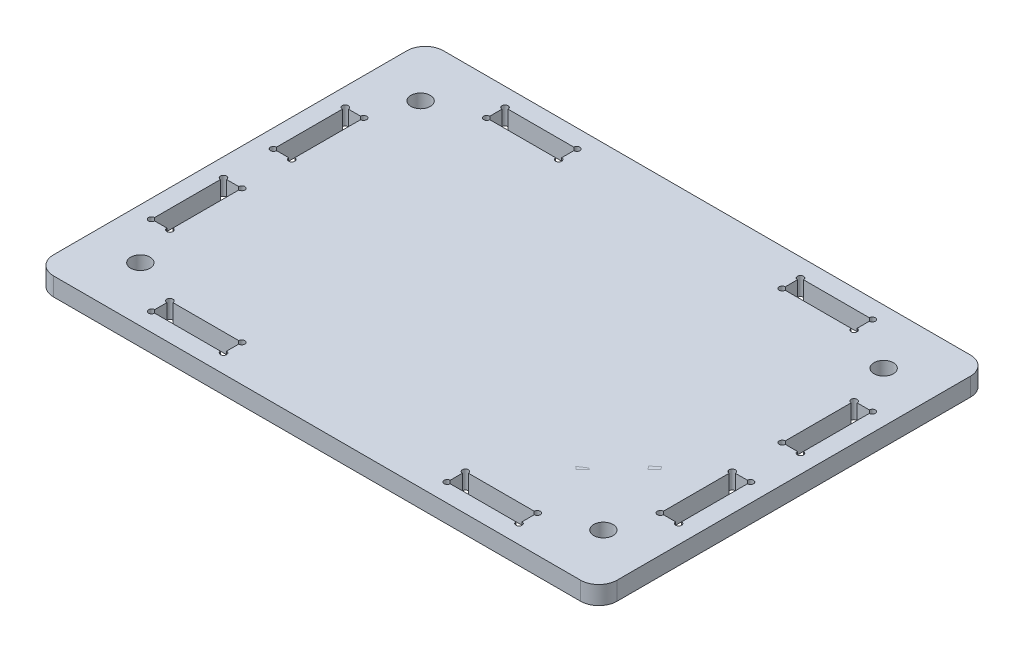
from build123d import *

# Parameters (mm, degrees)
SKETCH5_R              = 1.5875
BOSS_EXTRUDE1_DEPTH    = 3
SKETCH6_R              = 5
SKETCH6_R_2            = 3.5
BOSS_EXTRUDE2_DEPTH    = 0.2
SKETCH6_R_3            = 2
BOSS_EXTRUDE2_2_DEPTH  = 0.2
BOSS_EXTRUDE2_3_DEPTH  = 0.2
BOSS_EXTRUDE2_4_DEPTH  = 0.2
BOSS_EXTRUDE2_5_DEPTH  = 0.2
BOSS_EXTRUDE2_6_DEPTH  = 0.2
BOSS_EXTRUDE2_7_DEPTH  = 0.2
BOSS_EXTRUDE2_8_DEPTH  = 0.2
BOSS_EXTRUDE2_9_DEPTH  = 0.2
BOSS_EXTRUDE2_10_DEPTH = 0.2
BOSS_EXTRUDE2_11_DEPTH = 0.2
SKETCH6_W              = 7.5
SKETCH6_H              = 1.875
BOSS_EXTRUDE2_12_DEPTH = 0.2
BOSS_EXTRUDE2_13_DEPTH = 0.2
BOSS_EXTRUDE2_14_DEPTH = 0.2
BOSS_EXTRUDE2_15_DEPTH = 0.2
BOSS_EXTRUDE2_16_DEPTH = 0.2
BOSS_EXTRUDE2_17_DEPTH = 0.2
BOSS_EXTRUDE2_18_DEPTH = 0.2
BOSS_EXTRUDE2_19_DEPTH = 0.2
SKETCH6_H_2            = 7.5
BOSS_EXTRUDE2_20_DEPTH = 0.2


with BuildPart() as part:
    # Sketch5 → Boss-Extrude1 (new body)
    with BuildSketch(Plane(origin=(0, 0, 0), x_dir=(1, 0, 0), z_dir=(0, 1, 0))):
        with BuildLine():
            Line((-3.25, -7), (83.25, -7))
            ThreePointArc((83.25, -7), (85.371320344, -6.121320344), (86.25, -4))
            Line((86.25, -4), (86.25, 54))
            ThreePointArc((86.25, 54), (85.371320344, 56.121320344), (83.25, 57))
            Line((83.25, 57), (-3.25, 57))
            ThreePointArc((-3.25, 57), (-5.371320344, 56.121320344), (-6.25, 54))
            Line((-6.25, 54), (-6.25, -4))
            ThreePointArc((-6.25, -4), (-5.371320344, -6.121320344), (-3.25, -7))
        make_face()
        with Locations(Location((2, 2, 0), (0, 0, 270))):
            Circle(SKETCH5_R, mode=Mode.SUBTRACT)
        with Locations(Location((2, 48, 0), (0, 0, 270))):
            Circle(SKETCH5_R, mode=Mode.SUBTRACT)
        with Locations(Location((78, 48, 0), (0, 0, 270))):
            Circle(SKETCH5_R, mode=Mode.SUBTRACT)
        with Locations(Location((78, 2, 0), (0, 0, 270))):
            Circle(SKETCH5_R, mode=Mode.SUBTRACT)
        with BuildLine():
            Line((10.353326987, 54), (21.153326987, 54))
            ThreePointArc((21.153326987, 54), (22.006880378, 54.353553391), (21.653326987, 53.5))
            Line((21.653326987, 53.5), (21.653326987, 51.5))
            ThreePointArc((21.653326987, 51.5), (22.006880378, 50.646446609), (21.153326987, 51))
            Line((21.153326987, 51), (10.353326987, 51))
            ThreePointArc((10.353326987, 51), (9.499773597, 50.646446609), (9.853326987, 51.5))
            Line((9.853326987, 51.5), (9.853326987, 53.5))
            ThreePointArc((9.853326987, 53.5), (9.499773597, 54.353553391), (10.353326987, 54))
        make_face(mode=Mode.SUBTRACT)
        with BuildLine():
            Line((58.85, 54), (69.65, 54))
            ThreePointArc((69.65, 54), (70.503553391, 54.353553391), (70.15, 53.5))
            Line((70.15, 53.5), (70.15, 51.5))
            ThreePointArc((70.15, 51.5), (70.503553391, 50.646446609), (69.65, 51))
            Line((69.65, 51), (58.85, 51))
            ThreePointArc((58.85, 51), (57.996446609, 50.646446609), (58.35, 51.5))
            Line((58.35, 51.5), (58.35, 53.5))
            ThreePointArc((58.35, 53.5), (57.996446609, 54.353553391), (58.85, 54))
        make_face(mode=Mode.SUBTRACT)
        with BuildLine():
            Line((10.35, -1), (21.15, -1))
            ThreePointArc((21.15, -1), (22.003553391, -0.646446609), (21.65, -1.5))
            Line((21.65, -1.5), (21.65, -3.5))
            ThreePointArc((21.65, -3.5), (22.003553391, -4.353553391), (21.15, -4))
            Line((21.15, -4), (10.35, -4))
            ThreePointArc((10.35, -4), (9.496446609, -4.353553391), (9.85, -3.5))
            Line((9.85, -3.5), (9.85, -1.5))
            ThreePointArc((9.85, -1.5), (9.496446609, -0.646446609), (10.35, -1))
        make_face(mode=Mode.SUBTRACT)
        with BuildLine():
            Line((58.85, -1), (69.65, -1))
            ThreePointArc((69.65, -1), (70.503553391, -0.646446609), (70.15, -1.5))
            Line((70.15, -1.5), (70.15, -3.5))
            ThreePointArc((70.15, -3.5), (70.503553391, -4.353553391), (69.65, -4))
            Line((69.65, -4), (58.85, -4))
            ThreePointArc((58.85, -4), (57.996446609, -4.353553391), (58.35, -3.5))
            Line((58.35, -3.5), (58.35, -1.5))
            ThreePointArc((58.35, -1.5), (57.996446609, -0.646446609), (58.85, -1))
        make_face(mode=Mode.SUBTRACT)
        with BuildLine():
            Line((-3.25, 9.6), (-3.25, 20.4))
            ThreePointArc((-3.25, 20.4), (-3.603553391, 21.253553391), (-2.75, 20.9))
            Line((-2.75, 20.9), (-0.75, 20.9))
            ThreePointArc((-0.75, 20.9), (0.103553391, 21.253553391), (-0.25, 20.4))
            Line((-0.25, 20.4), (-0.25, 9.6))
            ThreePointArc((-0.25, 9.6), (0.103553391, 8.746446609), (-0.75, 9.1))
            Line((-0.75, 9.1), (-2.75, 9.1))
            ThreePointArc((-2.75, 9.1), (-3.603553391, 8.746446609), (-3.25, 9.6))
        make_face(mode=Mode.SUBTRACT)
        with BuildLine():
            Line((-3.25, 29.6), (-3.25, 40.4))
            ThreePointArc((-3.25, 40.4), (-3.603553391, 41.253553391), (-2.75, 40.9))
            Line((-2.75, 40.9), (-0.75, 40.9))
            ThreePointArc((-0.75, 40.9), (0.103553391, 41.253553391), (-0.25, 40.4))
            Line((-0.25, 40.4), (-0.25, 29.6))
            ThreePointArc((-0.25, 29.6), (0.103553391, 28.746446609), (-0.75, 29.1))
            Line((-0.75, 29.1), (-2.75, 29.1))
            ThreePointArc((-2.75, 29.1), (-3.603553391, 28.746446609), (-3.25, 29.6))
        make_face(mode=Mode.SUBTRACT)
        with BuildLine():
            Line((80.25, 9.6), (80.25, 20.4))
            ThreePointArc((80.25, 20.4), (79.896446609, 21.253553391), (80.75, 20.9))
            Line((80.75, 20.9), (82.75, 20.9))
            ThreePointArc((82.75, 20.9), (83.603553391, 21.253553391), (83.25, 20.4))
            Line((83.25, 20.4), (83.25, 9.6))
            ThreePointArc((83.25, 9.6), (83.603553391, 8.746446609), (82.75, 9.1))
            Line((82.75, 9.1), (80.75, 9.1))
            ThreePointArc((80.75, 9.1), (79.896446609, 8.746446609), (80.25, 9.6))
        make_face(mode=Mode.SUBTRACT)
        with BuildLine():
            Line((80.25, 29.6), (80.25, 40.4))
            ThreePointArc((80.25, 40.4), (79.896446609, 41.253553391), (80.75, 40.9))
            Line((80.75, 40.9), (82.75, 40.9))
            ThreePointArc((82.75, 40.9), (83.603553391, 41.253553391), (83.25, 40.4))
            Line((83.25, 40.4), (83.25, 29.6))
            ThreePointArc((83.25, 29.6), (83.603553391, 28.746446609), (82.75, 29.1))
            Line((82.75, 29.1), (80.75, 29.1))
            ThreePointArc((80.75, 29.1), (79.896446609, 28.746446609), (80.25, 29.6))
        make_face(mode=Mode.SUBTRACT)
    extrude(amount=BOSS_EXTRUDE1_DEPTH)


with BuildPart() as body_2:
    # Sketch6 → Boss-Extrude2 (new body)
    with BuildSketch(Plane(origin=(0, 3, 0), x_dir=(1, 0, 0), z_dir=(0, 1, 0))):
        with Locations(Location((70, 37.5, 0), (0, 0, 270))):
            Circle(SKETCH6_R)
        with Locations(Location((70, 37.5, 0), (0, 0, 270))):
            Circle(SKETCH6_R_2, mode=Mode.SUBTRACT)
    extrude(amount=-BOSS_EXTRUDE2_DEPTH)


with BuildPart() as body_3:
    # Sketch6 → Boss-Extrude2 2 (new body)
    with BuildSketch(Plane(origin=(0, 3, 0), x_dir=(1, 0, 0), z_dir=(0, 1, 0))):
        with Locations(Location((70, 37.5, 0), (0, 0, 270))):
            Circle(SKETCH6_R_3)
    extrude(amount=-BOSS_EXTRUDE2_2_DEPTH)


with BuildPart() as body_4:
    # Sketch6 → Boss-Extrude2 3 (new body)
    with BuildSketch(Plane(origin=(0, 3, 0), x_dir=(1, 0, 0), z_dir=(0, 1, 0))):
        with BuildLine():
            Line((72.759643105, 8.330543209), (73.173589571, 7.70512469))
            Line((73.173589571, 7.70512469), (71.094859602, 8.128068796))
            Line((71.094859602, 8.128068796), (71.517803708, 10.206798765))
            Line((71.517803708, 10.206798765), (71.931750173, 9.581380246))
            ThreePointArc((71.931750173, 9.581380246), (73.351504822, 13.50867013), (70, 16))
            Line((70, 16), (70, 17.5))
            ThreePointArc((70, 17.5), (74.787864031, 13.940957328), (72.759643105, 8.330543209))
        make_face()
    extrude(amount=-BOSS_EXTRUDE2_3_DEPTH)


with BuildPart() as body_5:
    # Sketch6 → Boss-Extrude2 4 (new body)
    with BuildSketch(Plane(origin=(0, 3, 0), x_dir=(1, 0, 0), z_dir=(0, 1, 0))):
        with BuildLine():
            Line((67.240356895, 16.669456791), (66.826410429, 17.29487531))
            Line((66.826410429, 17.29487531), (68.905140398, 16.871931204))
            Line((68.905140398, 16.871931204), (68.482196292, 14.793201235))
            Line((68.482196292, 14.793201235), (68.068249827, 15.418619754))
            ThreePointArc((68.068249827, 15.418619754), (66.648495178, 11.49132987), (70, 9))
            Line((70, 9), (70, 7.5))
            ThreePointArc((70, 7.5), (65.212135969, 11.059042672), (67.240356895, 16.669456791))
        make_face()
    extrude(amount=-BOSS_EXTRUDE2_4_DEPTH)


with BuildPart() as body_6:
    # Sketch6 → Boss-Extrude2 5 (new body)
    with BuildSketch(Plane(origin=(0, 3, 0), x_dir=(1, 0, 0), z_dir=(0, 1, 0))):
        Polygon((55, 36.062704137), (52, 32.64), (52, 30.64), (48, 30.64), (48, 32.64), (45, 36.062704137), align=None)
    extrude(amount=-BOSS_EXTRUDE2_5_DEPTH)


with BuildPart() as body_7:
    # Sketch6 → Boss-Extrude2 6 (new body)
    with BuildSketch(Plane(origin=(0, 3, 0), x_dir=(1, 0, 0), z_dir=(0, 1, 0))):
        with BuildLine():
            ThreePointArc((47.65, 37.497071421), (47.642928579, 36.79), (48.35, 36.782928579))
            ThreePointArc((48.35, 36.782928579), (50.003829046, 37.494466561), (51.65, 36.765386314))
            ThreePointArc((51.65, 36.765386314), (52.357071421, 36.772457735), (52.35, 37.479529156))
            ThreePointArc((52.35, 37.479529156), (50.003751117, 38.493315991), (47.65, 37.497071421))
        make_face()
    extrude(amount=-BOSS_EXTRUDE2_6_DEPTH)


with BuildPart() as body_8:
    # Sketch6 → Boss-Extrude2 7 (new body)
    with BuildSketch(Plane(origin=(0, 3, 0), x_dir=(1, 0, 0), z_dir=(0, 1, 0))):
        with BuildLine():
            ThreePointArc((46.65, 39.997071421), (46.642928579, 39.29), (47.35, 39.282928579))
            ThreePointArc((47.35, 39.282928579), (50.003629954, 40.370866104), (52.65, 39.265386314))
            ThreePointArc((52.65, 39.265386314), (53.357071421, 39.272457735), (53.35, 39.979529156))
            ThreePointArc((53.35, 39.979529156), (50.003619768, 41.370815325), (46.65, 39.997071421))
        make_face()
    extrude(amount=-BOSS_EXTRUDE2_7_DEPTH)


with BuildPart() as body_9:
    # Sketch6 → Boss-Extrude2 8 (new body)
    with BuildSketch(Plane(origin=(0, 3, 0), x_dir=(1, 0, 0), z_dir=(0, 1, 0))):
        with BuildLine():
            ThreePointArc((45.65, 42.497071421), (50.003765563, 44.355812607), (54.35, 42.479529156))
            ThreePointArc((54.35, 42.479529156), (54.357071421, 41.772457735), (53.65, 41.765386314))
            ThreePointArc((53.65, 41.765386314), (50.003803478, 43.356928408), (46.35, 41.782928579))
            ThreePointArc((46.35, 41.782928579), (45.642928579, 41.79), (45.65, 42.497071421))
        make_face()
    extrude(amount=-BOSS_EXTRUDE2_8_DEPTH)


with BuildPart() as body_10:
    # Sketch6 → Boss-Extrude2 9 (new body)
    with BuildSketch(Plane(origin=(0, 3, 0), x_dir=(1, 0, 0), z_dir=(0, 1, 0))):
        Polygon((55, 13.922704137), (52, 10.5), (52, 8.5), (48, 8.5), (48, 10.5), (45, 13.922704137), align=None)
    extrude(amount=-BOSS_EXTRUDE2_9_DEPTH)


with BuildPart() as body_11:
    # Sketch6 → Boss-Extrude2 10 (new body)
    with BuildSketch(Plane(origin=(0, 3, 0), x_dir=(1, 0, 0), z_dir=(0, 1, 0))):
        with BuildLine():
            ThreePointArc((47.65, 15.357071421), (47.642928579, 14.65), (48.35, 14.642928579))
            ThreePointArc((48.35, 14.642928579), (50.003829046, 15.354466561), (51.65, 14.625386314))
            ThreePointArc((51.65, 14.625386314), (52.357071421, 14.632457735), (52.35, 15.339529156))
            ThreePointArc((52.35, 15.339529156), (50.003751117, 16.353315991), (47.65, 15.357071421))
        make_face()
    extrude(amount=-BOSS_EXTRUDE2_10_DEPTH)


with BuildPart() as body_12:
    # Sketch6 → Boss-Extrude2 11 (new body)
    with BuildSketch(Plane(origin=(0, 3, 0), x_dir=(1, 0, 0), z_dir=(0, 1, 0))):
        Polygon((33.75, 36.5625), (30, 44.0625), (26.25, 36.5625), align=None)
    extrude(amount=-BOSS_EXTRUDE2_11_DEPTH)


with BuildPart() as body_13:
    # Sketch6 → Boss-Extrude2 12 (new body)
    with BuildSketch(Plane(origin=(0, 3, 0), x_dir=(1, 0, 0), z_dir=(0, 1, 0))):
        with Locations((30, 45)):
            Rectangle(SKETCH6_W, SKETCH6_H)
    extrude(amount=-BOSS_EXTRUDE2_12_DEPTH)


with BuildPart() as body_14:
    # Sketch6 → Boss-Extrude2 13 (new body)
    with BuildSketch(Plane(origin=(0, 3, 0), x_dir=(1, 0, 0), z_dir=(0, 1, 0))):
        Polygon((30, 36.5625), (33.75, 29.0625), (26.25, 29.0625), align=None)
    extrude(amount=-BOSS_EXTRUDE2_13_DEPTH)


with BuildPart() as body_15:
    # Sketch6 → Boss-Extrude2 14 (new body)
    with BuildSketch(Plane(origin=(0, 3, 0), x_dir=(1, 0, 0), z_dir=(0, 1, 0))):
        Polygon((30.000000304, 13.4375), (26.25, 20.937500152), (33.75, 20.937499848), align=None)
    extrude(amount=-BOSS_EXTRUDE2_14_DEPTH)


with BuildPart() as body_16:
    # Sketch6 → Boss-Extrude2 15 (new body)
    with BuildSketch(Plane(origin=(0, 3, 0), x_dir=(1, 0, 0), z_dir=(0, 1, 0))):
        Polygon((26.25, 13.437500152), (30, 5.9375), (33.75, 13.437499848), align=None)
    extrude(amount=-BOSS_EXTRUDE2_15_DEPTH)


with BuildPart() as body_17:
    # Sketch6 → Boss-Extrude2 16 (new body)
    with BuildSketch(Plane(origin=(0, 3, 0), x_dir=(1, 0, 0), z_dir=(0, 1, 0))):
        with Locations((30, 5)):
            Rectangle(SKETCH6_W, SKETCH6_H)
    extrude(amount=-BOSS_EXTRUDE2_16_DEPTH)


with BuildPart() as body_18:
    # Sketch6 → Boss-Extrude2 17 (new body)
    with BuildSketch(Plane(origin=(0, 3, 0), x_dir=(1, 0, 0), z_dir=(0, 1, 0))):
        Polygon((10, 11.5625), (13.75, 4.0625), (6.25, 4.0625), align=None)
    extrude(amount=-BOSS_EXTRUDE2_17_DEPTH)


with BuildPart() as body_19:
    # Sketch6 → Boss-Extrude2 18 (new body)
    with BuildSketch(Plane(origin=(0, 3, 0), x_dir=(1, 0, 0), z_dir=(0, 1, 0))):
        with Locations((10, 16.25)):
            Rectangle(SKETCH6_W, SKETCH6_H)
    extrude(amount=-BOSS_EXTRUDE2_18_DEPTH)


with BuildPart() as body_20:
    # Sketch6 → Boss-Extrude2 19 (new body)
    with BuildSketch(Plane(origin=(0, 3, 0), x_dir=(1, 0, 0), z_dir=(0, 1, 0))):
        with Locations((10, 20)):
            Rectangle(SKETCH6_W, SKETCH6_H)
    extrude(amount=-BOSS_EXTRUDE2_19_DEPTH)


with BuildPart() as body_21:
    # Sketch6 → Boss-Extrude2 20 (new body)
    with BuildSketch(Plane(origin=(0, 3, 0), x_dir=(1, 0, 0), z_dir=(0, 1, 0))):
        with Locations((10, 37.5)):
            Rectangle(SKETCH6_W, SKETCH6_H_2)
    extrude(amount=-BOSS_EXTRUDE2_20_DEPTH)


solid = Compound([part.part, body_2.part, body_3.part, body_4.part, body_5.part, body_6.part, body_7.part, body_8.part, body_9.part, body_10.part, body_11.part, body_12.part, body_13.part, body_14.part, body_15.part, body_16.part, body_17.part, body_18.part, body_19.part, body_20.part, body_21.part])
